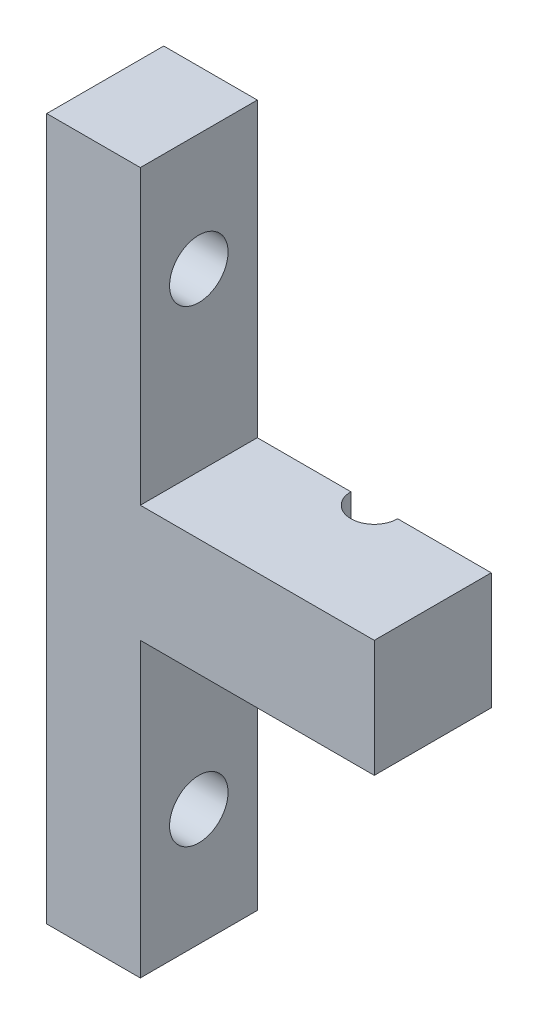
from build123d import *

# Parameters (mm, degrees)
SKETCH1_W           = 4
SKETCH1_H           = 5
BOSS_EXTRUDE1_DEPTH = 30
SKETCH2_W           = 5
SKETCH2_H           = 5
BOSS_EXTRUDE2_DEPTH = 10
SKETCH3_R           = 1.25
CUT_EXTRUDE1_DEPTH  = 33.015621187
CUT_EXTRUDE2_DEPTH  = 34.481338086


with BuildPart() as part:
    # Sketch1 → Boss-Extrude1 (new body)
    with BuildSketch(Plane(origin=(0, 0, 0), x_dir=(1, 0, 0), z_dir=(0, 1, 0))):
        with Locations((2, -2.5)):
            Rectangle(SKETCH1_W, SKETCH1_H)
    extrude(amount=BOSS_EXTRUDE1_DEPTH)

    # Sketch2 → Boss-Extrude2 (add)
    with BuildSketch(Plane(origin=(4, 0, 0), x_dir=(0, 0, -1), z_dir=(1, 0, 0))):
        with Locations((-2.5, 15)):
            Rectangle(SKETCH2_W, SKETCH2_H)
    extrude(amount=BOSS_EXTRUDE2_DEPTH)

    # Sketch3 → Cut-Extrude1 (cut, through all)
    with BuildSketch(Plane(origin=(4, 0, 0), x_dir=(0, 0, -1), z_dir=(1, 0, 0))):
        with Locations((-2.5, 25)):
            Circle(SKETCH3_R)
        with Locations(Location((-2.5, 5, 0), (0, 0, 180))):
            Circle(SKETCH3_R)
    extrude(amount=-CUT_EXTRUDE1_DEPTH, mode=Mode.SUBTRACT)

    # Sketch4 → Cut-Extrude2 (cut, through all)
    with BuildSketch(Plane(origin=(0, 0, 0), x_dir=(1, 0, 0), z_dir=(0, 1, 0))):
        with BuildLine():
            Line((8, 0), (10, 0))
            ThreePointArc((10, 0), (9, -1), (8, 0))
        make_face()
    extrude(amount=CUT_EXTRUDE2_DEPTH, mode=Mode.SUBTRACT)


solid = part.part
